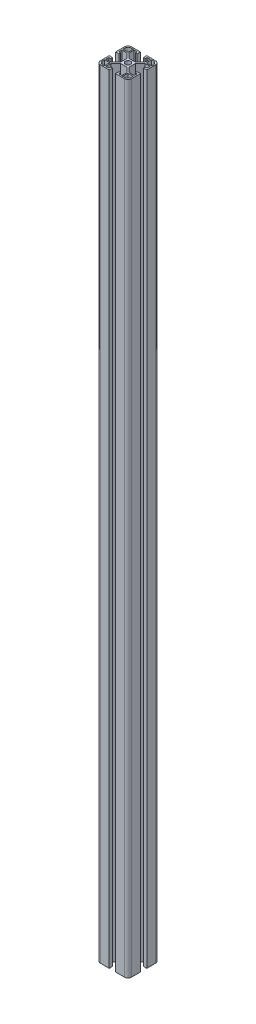
from build123d import *

# Parameters (mm, degrees)
SKETCH1_W           = 40
SKETCH1_H           = 40
BOSS_EXTRUDE1_DEPTH = 1000
SKETCH2_R           = 3.4
SKETCH2_W           = 6.95
SKETCH2_H           = 6.75
SKETCH2_W_2         = 6.75
SKETCH2_H_2         = 6.95
CUT_EXTRUDE1_DEPTH  = 1002.598722044
FILLET1_R           = 4.5


with BuildPart() as part:
    # Sketch1 → Boss-Extrude1 (new body)
    with BuildSketch(Plane(origin=(0, 0, 0), x_dir=(1, 0, 0), z_dir=(0, 1, 0))):
        with Locations((20, 20)):
            Rectangle(SKETCH1_W, SKETCH1_H)
    extrude(amount=BOSS_EXTRUDE1_DEPTH)

    # Sketch2 → Cut-Extrude1 (cut, through all)
    with BuildSketch(Plane(origin=(0, 1000, 0), x_dir=(1, 0, 0), z_dir=(0, 1, 0))):
        with Locations(Location((20, 20, 0), (0, 0, 270))):
            Circle(SKETCH2_R)
        Polygon((30.25, 31.75), (24, 25.5), (16, 25.5), (9.75, 31.75), (9.75, 38.2), (13.6, 38.2), (13.6, 35.75), (15.9, 35.75), (15.9, 40), (24.1, 40), (24.1, 35.75), (26.4, 35.75), (26.4, 38.2), (30.25, 38.2), align=None)
        Polygon((31.75, 9.75), (25.5, 16), (25.5, 24), (31.75, 30.25), (38.2, 30.25), (38.2, 26.4), (35.75, 26.4), (35.75, 24.1), (40, 24.1), (40, 15.9), (35.75, 15.9), (35.75, 13.6), (38.2, 13.6), (38.2, 9.75), align=None)
        with Locations((4.975, 35.125)):
            Rectangle(SKETCH2_W, SKETCH2_H)
        with Locations((35.125, 35.025)):
            Rectangle(SKETCH2_W_2, SKETCH2_H_2)
        Polygon((9.75, 8.25), (16, 14.5), (24, 14.5), (30.25, 8.25), (30.25, 1.8), (26.4, 1.8), (26.4, 4.25), (24.1, 4.25), (24.1, 0), (15.9, 0), (15.9, 4.25), (13.6, 4.25), (13.6, 1.8), (9.75, 1.8), align=None)
        with Locations((35.025, 4.875)):
            Rectangle(SKETCH2_W, SKETCH2_H)
        Polygon((8.25, 30.25), (14.5, 24), (14.5, 16), (8.25, 9.75), (1.8, 9.75), (1.8, 13.6), (4.25, 13.6), (4.25, 15.9), (0, 15.9), (0, 24.1), (4.25, 24.1), (4.25, 26.4), (1.8, 26.4), (1.8, 30.25), align=None)
        with Locations((4.875, 4.975)):
            Rectangle(SKETCH2_W_2, SKETCH2_H_2)
    extrude(amount=-CUT_EXTRUDE1_DEPTH, mode=Mode.SUBTRACT)

    # Fillet1
    fillet1_edges = [part.edges().sort_by_distance(p)[0] for p in [
        (38.5, 500, -38.5),
        (1.5, 500, -1.5),
        (38.5, 500, -1.5),
        (0, 500, -40),
        (40, 500, -40),
        (40, 500, 0),
        (0, 500, 0),
        (1.5, 500, -38.5),
    ]]
    fillet(fillet1_edges, radius=FILLET1_R)


solid = part.part
